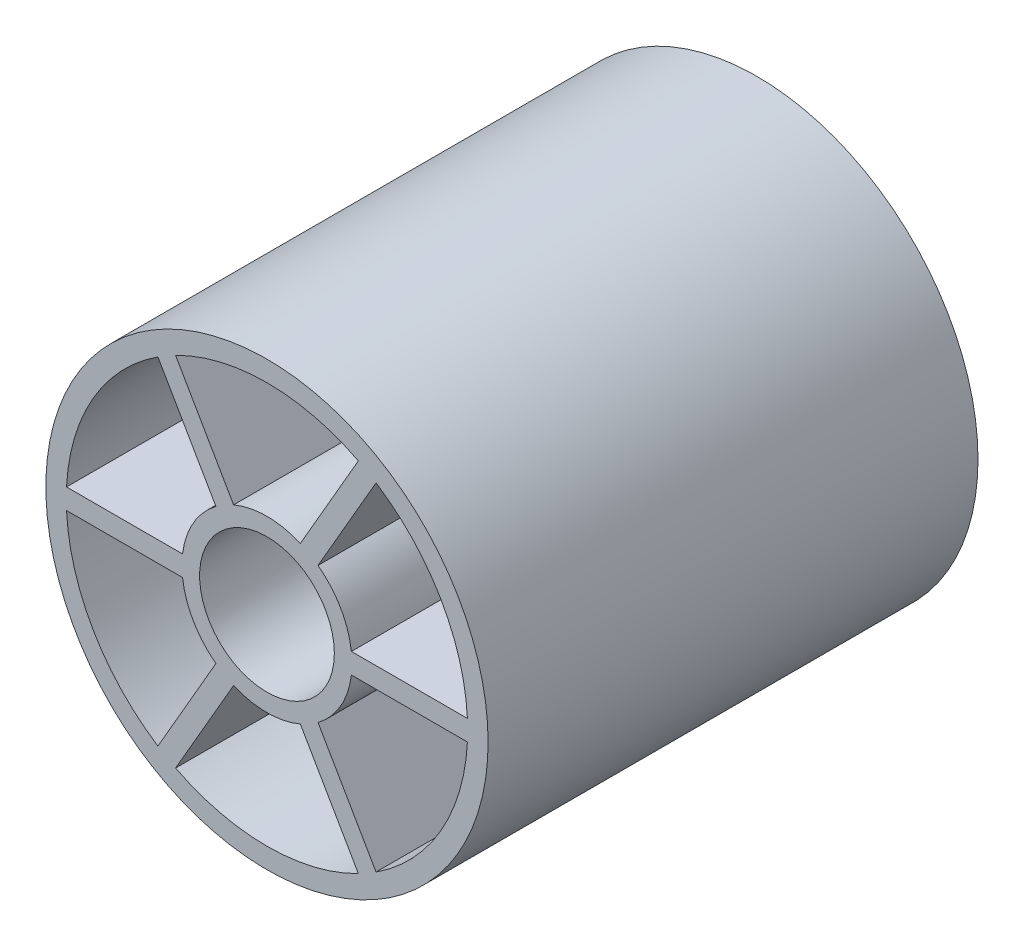
from build123d import *

# Parameters (mm, degrees)
SKETCH1_R           = 32.5
SKETCH1_R_2         = 29.5
BOSS_EXTRUDE1_DEPTH = 72
BOSS_EXTRUDE2_DEPTH = 72
CIRPATTERN1_COUNT   = 3
CIRPATTERN1_ANGLE   = 120
SKETCH7_R           = 12.5
BOSS_EXTRUDE5_DEPTH = 72
SKETCH9_R           = 9.9
CUT_EXTRUDE4_DEPTH  = 86.419552797


with BuildPart() as part:
    # Sketch1 → Boss-Extrude1 (new body)
    with BuildSketch(Plane.XY):
        Circle(SKETCH1_R)
        Circle(SKETCH1_R_2, mode=Mode.SUBTRACT)
    extrude(amount=BOSS_EXTRUDE1_DEPTH)

    # Sketch2 → Boss-Extrude2 (add, through all)
    with BuildSketch(Plane.XY):
        with BuildLine():
            Line((-29.461839725, -1.5), (29.461839725, -1.5))
            ThreePointArc((29.461839725, -1.5), (29.5, 0), (29.461839725, 1.5))
            Line((29.461839725, 1.5), (-29.461839725, 1.5))
            ThreePointArc((-29.461839725, 1.5), (-29.5, 0), (-29.461839725, -1.5))
        make_face()
    boss_extrude2 = extrude(amount=BOSS_EXTRUDE2_DEPTH)

    # CirPattern1: Boss-Extrude2 ×3 about axis
    cirpattern1_axis = Axis((0, 0, 0), (0, 0, 1))
    for i in range(1, CIRPATTERN1_COUNT):
        add(boss_extrude2.rotate(cirpattern1_axis, i * CIRPATTERN1_ANGLE / (CIRPATTERN1_COUNT - 1)))

    # Sketch7 → Boss-Extrude5 (add, through all)
    with BuildSketch(Plane.XY):
        Circle(SKETCH7_R)
    extrude(amount=BOSS_EXTRUDE5_DEPTH)

    # Sketch9 → Cut-Extrude4 (cut, through all)
    with BuildSketch(Plane.XY):
        Circle(SKETCH9_R)
    extrude(amount=CUT_EXTRUDE4_DEPTH, mode=Mode.SUBTRACT)


solid = part.part
